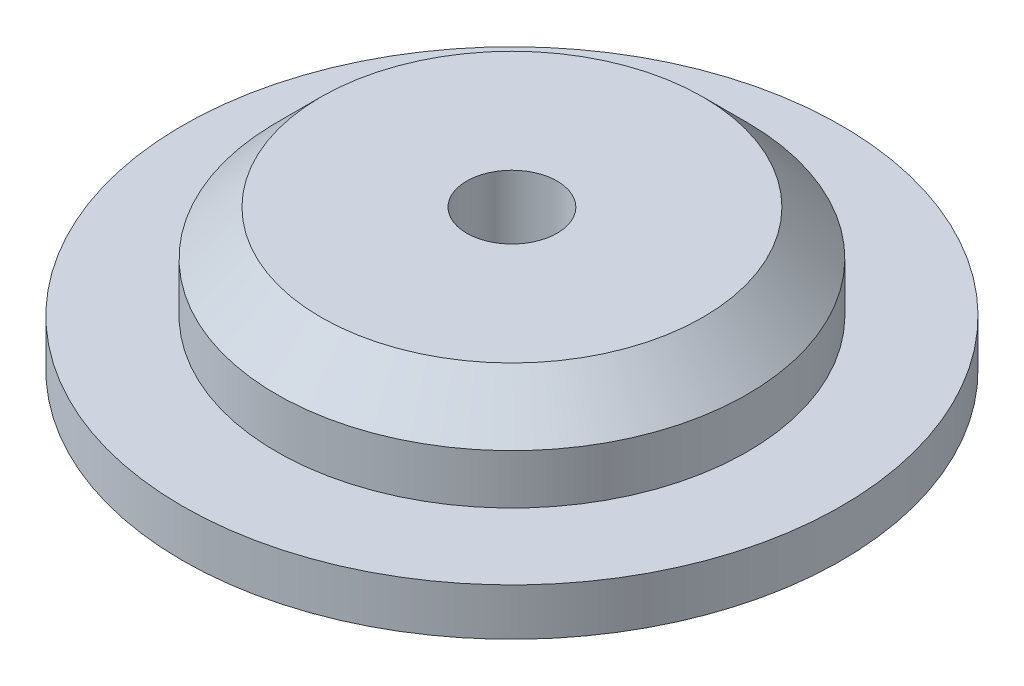
from build123d import *

# Parameters (mm, degrees)
SKETCH1_R           = 22.225
SKETCH1_R_2         = 15.875
BOSS_EXTRUDE1_DEPTH = 3.175
SKETCH1_4_R         = 15.875
SKETCH1_4_R_2       = 10.4
BOSS_EXTRUDE2_DEPTH = 9.525
BOSS_EXTRUDE3_START = -6.35
SKETCH2_R           = 10.4
SKETCH2_R_2         = 3.05
BOSS_EXTRUDE3_DEPTH = 6.35
CHAMFER2_SIZE       = 3


with BuildPart() as part:
    # Sketch1 → Boss-Extrude1 (new body)
    with BuildSketch(Plane(origin=(0, 0, 0), x_dir=(1, 0, 0), z_dir=(0, 1, 0))):
        Circle(SKETCH1_R)
        Circle(SKETCH1_R_2, mode=Mode.SUBTRACT)
    extrude(amount=BOSS_EXTRUDE1_DEPTH)

    # Sketch1<4> → Boss-Extrude2 (add)
    with BuildSketch(Plane(origin=(0, 0, 0), x_dir=(1, 0, 0), z_dir=(0, 1, 0))):
        Circle(SKETCH1_4_R)
        Circle(SKETCH1_4_R_2, mode=Mode.SUBTRACT)
    extrude(amount=BOSS_EXTRUDE2_DEPTH)

    # Sketch2 → Boss-Extrude3 (add)
    with BuildSketch(Plane(origin=(0, 9.525, 0), x_dir=(1, 0, 0), z_dir=(0, 1, 0)).offset(BOSS_EXTRUDE3_START)):
        Circle(SKETCH2_R)
        Circle(SKETCH2_R_2, mode=Mode.SUBTRACT)
    extrude(amount=BOSS_EXTRUDE3_DEPTH)

    # Chamfer2
    chamfer2_edges = [part.edges().sort_by_distance(p)[0] for p in [
        (-15.875, 9.525, 0),
    ]]
    chamfer(chamfer2_edges, length=CHAMFER2_SIZE)


solid = part.part
